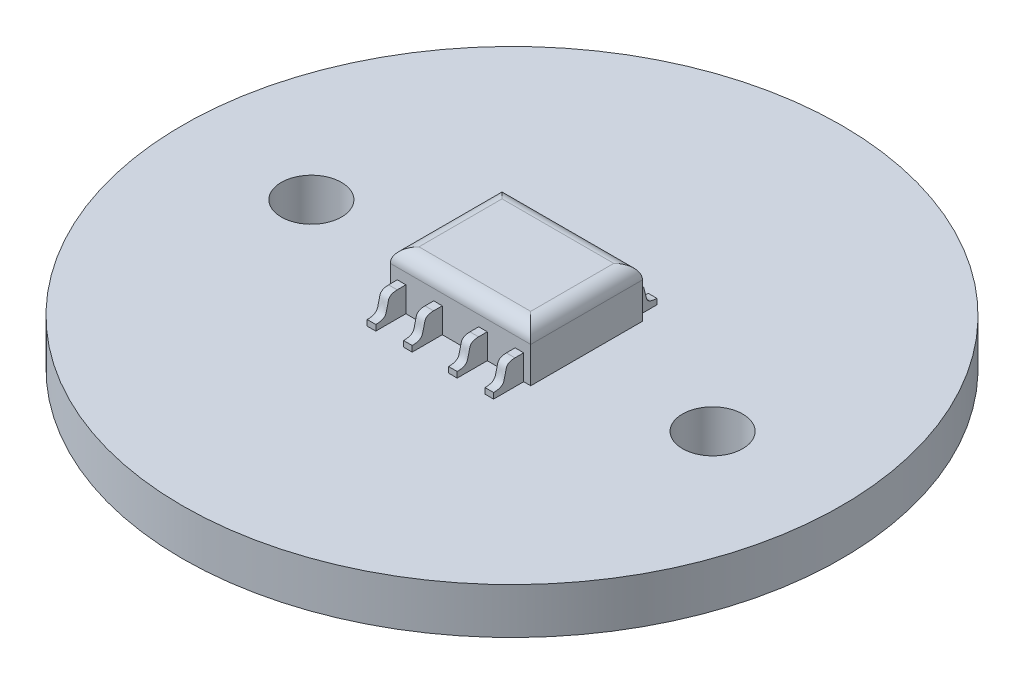
from build123d import *

# Parameters (mm, degrees)
SKETCH1_R               = 11.5
SKETCH1_R_2             = 1.05
BOSS_EXTRUDE1_DEPTH     = 1.6
SKETCH2_W               = 4.9
SKETCH2_H               = 3.9
BOSS_EXTRUDE2_DEPTH     = 1.75
SKETCH3_W               = 0.3
SKETCH3_H               = 1.05
BOSS_EXTRUDE3_DEPTH     = 0.875
MIRROR2_COPY_1_SKETCH_W = 0.3
MIRROR2_COPY_1_SKETCH_H = 1.05
MIRROR2_COPY_1_DEPTH    = 0.875
FILLET1_R               = 0.5
CUT_EXTRUDE1_DEPTH      = 19.201635229


with BuildPart() as part:
    # Sketch1 → Boss-Extrude1 (new body)
    with BuildSketch(Plane(origin=(0, 0, 0), x_dir=(1, 0, 0), z_dir=(0, 1, 0))):
        with Locations(Location((0, 0, 0), (0, 0, 270))):
            Circle(SKETCH1_R)
        with Locations(Location((-7, 0, 0), (0, 0, 270))):
            Circle(SKETCH1_R_2, mode=Mode.SUBTRACT)
        with Locations(Location((7, 0, 0), (0, 0, 270))):
            Circle(SKETCH1_R_2, mode=Mode.SUBTRACT)
    extrude(amount=BOSS_EXTRUDE1_DEPTH)

    # Sketch2 → Boss-Extrude2 (add)
    with BuildSketch(Plane(origin=(0, 1.6, 0), x_dir=(1, 0, 0), z_dir=(0, 1, 0))):
        with Locations((0, 0.152758251)):
            Rectangle(SKETCH2_W, SKETCH2_H)
    extrude(amount=BOSS_EXTRUDE2_DEPTH)

    # Sketch3 → Boss-Extrude3 (add)
    with BuildSketch(Plane(origin=(0, 1.6, 0), x_dir=(1, 0, 0), z_dir=(0, 1, 0))):
        with Locations((-2.055, -2.322241749)):
            Rectangle(SKETCH3_W, SKETCH3_H)
        with Locations((-0.785, -2.322241749)):
            Rectangle(SKETCH3_W, SKETCH3_H)
    boss_extrude3 = extrude(amount=BOSS_EXTRUDE3_DEPTH)

    # Mirror1: Boss-Extrude3 across plane
    add(boss_extrude3.mirror(Plane(origin=(0, 0, 0), x_dir=(0, 0, 1), z_dir=(1, 0, 0))))

    # Mirror2: Boss-Extrude3 across plane
    add(boss_extrude3.mirror(Plane.XY))

    # Mirror2 copy 1 sketch → Mirror2 copy 1 (add)
    with BuildSketch(Plane(origin=(0, 1.6, 0), x_dir=(-1, 0, 0), z_dir=(0, 1, 0))):
        with Locations((-2.055, -2.322241749)):
            Rectangle(MIRROR2_COPY_1_SKETCH_W, MIRROR2_COPY_1_SKETCH_H)
        with Locations((-0.785, -2.322241749)):
            Rectangle(MIRROR2_COPY_1_SKETCH_W, MIRROR2_COPY_1_SKETCH_H)
    extrude(amount=MIRROR2_COPY_1_DEPTH)

    # Fillet1
    fillet1_edges = [part.edges().sort_by_distance(p)[0] for p in [
        (2.45, 3.35, -0.152758251),
        (0, 3.35, -2.102758251),
        (-2.45, 3.35, -0.152758251),
        (0, 3.35, 1.797241749),
    ]]
    fillet(fillet1_edges, radius=FILLET1_R)

    # Sketch4 → Cut-Extrude1 (cut, symmetric)
    with BuildSketch(Plane(origin=(2.205, 0, 0), x_dir=(0, 0, -1), z_dir=(1, 0, 0))):
        with BuildLine():
            Line((2.102758251, 2.475), (2.847241749, 2.475))
            Line((2.847241749, 2.475), (2.847241749, 1.8))
            add(Edge.make_bspline(
                [(2.102758251, 2.475), (2.265585891, 2.469119828), (2.343180096, 2.418848487), (2.418167502, 2.315792307), (2.432368545, 2.177966716), (2.513750701, 1.870806769), (2.648107294, 1.800605138), (2.847241749, 1.8)],
                knots=[0, 0, 0, 0, 0.320657498, 0.400502937, 0.754237561, 0.81860895, 1, 1, 1, 1], degree=3))
        make_face()
    cut_extrude1 = extrude(amount=CUT_EXTRUDE1_DEPTH, both=True, mode=Mode.SUBTRACT)

    # Mirror3: Cut-Extrude1 across plane
    add(cut_extrude1.mirror(Plane.XY), mode=Mode.SUBTRACT)


solid = part.part
